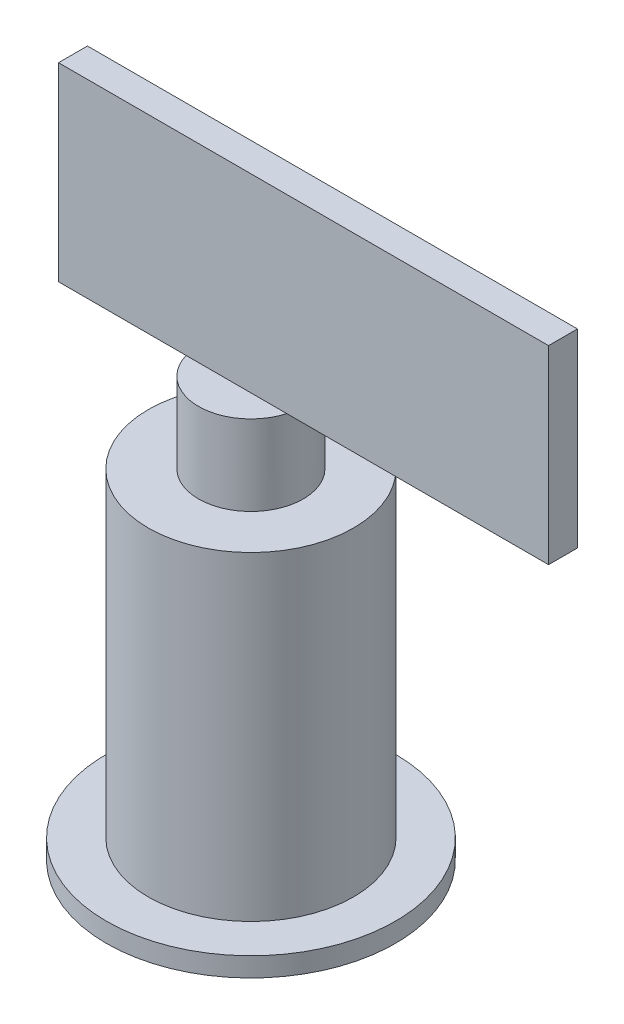
from build123d import *

# Parameters (mm, degrees)
SKETCH2_R                = 5.435
BOSS_EXTRUDE1_DEPTH      = 8.32
BOSS_EXTRUDE2_DEPTH      = 1.5
BOSS_EXTRUDE2_DEPTH_BACK = 1.5
SKETCH4_W                = 50.85
SKETCH4_H                = 19.69
SKETCH5_R                = 10.65
BOSS_EXTRUDE3_DEPTH      = 33.16
SKETCH6_R                = 15
BOSS_EXTRUDE4_DEPTH      = 2


with BuildPart() as part:
    # Sketch2 → Boss-Extrude1 (new body)
    with BuildSketch(Plane(origin=(0, 0, 0), x_dir=(1, 0, 0), z_dir=(0, 1, 0))):
        Circle(SKETCH2_R)
    extrude(amount=BOSS_EXTRUDE1_DEPTH)

    # Sketch4 → Boss-Extrude2 (add, two sides: drawn at the far end of the back side and taken through both)
    with BuildSketch(Plane.XY.offset(-BOSS_EXTRUDE2_DEPTH_BACK)):
        with Locations((6.96, 18.165)):
            Rectangle(SKETCH4_W, SKETCH4_H)
    extrude(amount=BOSS_EXTRUDE2_DEPTH + BOSS_EXTRUDE2_DEPTH_BACK)

    # Sketch5 → Boss-Extrude3 (add)
    with BuildSketch(Plane.XZ):
        Circle(SKETCH5_R)
    extrude(amount=BOSS_EXTRUDE3_DEPTH)

    # Sketch6 → Boss-Extrude4 (add)
    with BuildSketch(Plane.XZ.offset(33.16)):
        Circle(SKETCH6_R)
    extrude(amount=BOSS_EXTRUDE4_DEPTH)


solid = part.part
